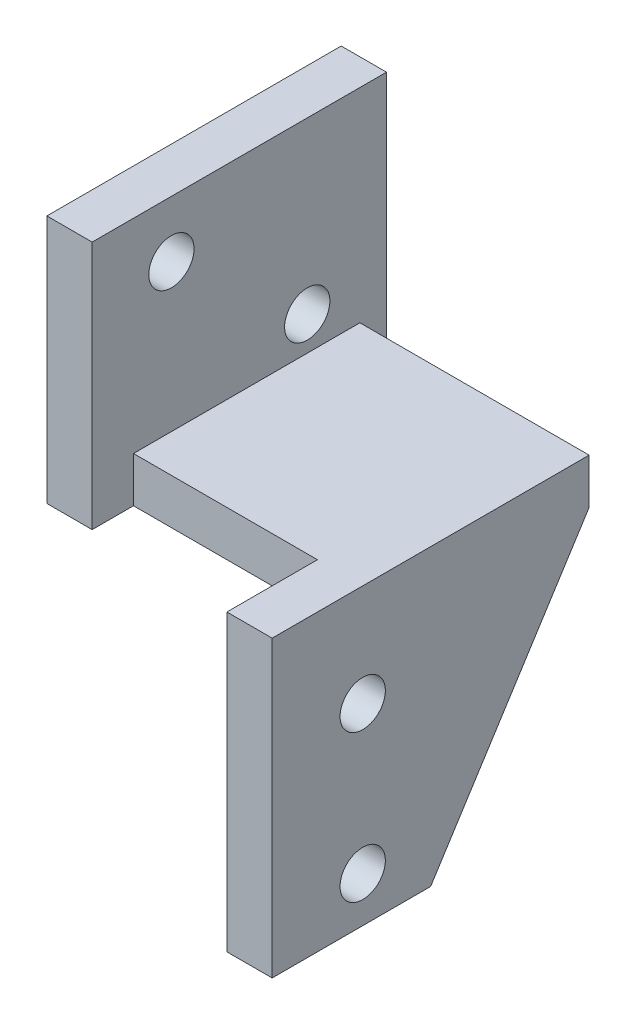
from build123d import *

# Parameters (mm, degrees)
BOSS_EXTRU_1_DEPTH      = 20
ESQUISSE3_W             = 4
ESQUISSE3_H             = 18
BOSS_EXTRU_2_DEPTH      = 20
ESQUISSE4_W             = 4
ESQUISSE4_H             = 18
BOSS_EXTRU_3_DEPTH      = 20
ESQUISSE5_W             = 17.65
ESQUISSE5_H             = 18
ESQUISSE5_W_2           = 16.35
ESQUISSE5_R             = 2
ENL_V_MAT_EXTRU_1_DEPTH = 20
ESQUISSE6_W             = 4
ESQUISSE6_H             = 26
BOSS_EXTRU_4_DEPTH      = 4
ESQUISSE7_R             = 2
ENL_V_MAT_EXTRU_2_DEPTH = 4
ESQUISSE8_R             = 2
ENL_V_MAT_EXTRU_3_DEPTH = 4
ESQUISSE9_W             = 4
ESQUISSE9_H             = 26
BOSS_EXTRU_5_DEPTH      = 8
ENL_V_MAT_EXTRU_5_DEPTH = 8


with BuildPart() as part:
    # Esquisse1 → Boss.-Extru.1 (new body)
    with BuildSketch(Plane.XY):
        Polygon((0, 16), (0, 0), (24.25, 0), (24.25, 2), (4, 2), (4, 16), align=None)
        Polygon((24.25, 0), (0, 0), (0, -2), (20.25, -2), (20.25, -24), (24.25, -24), align=None)
    extrude(amount=BOSS_EXTRU_1_DEPTH)

    # Esquisse3 → Boss.-Extru.2 (add)
    with BuildSketch(Plane(origin=(0, 0, 0), x_dir=(-1, 0, 0), z_dir=(0, 0, -1))):
        with Locations((-2, 7)):
            Rectangle(ESQUISSE3_W, ESQUISSE3_H)
    extrude(amount=BOSS_EXTRU_2_DEPTH)

    # Esquisse4 → Boss.-Extru.3 (add)
    with BuildSketch(Plane.XY.offset(20)):
        with Locations((2, 7)):
            Rectangle(ESQUISSE4_W, ESQUISSE4_H)
    extrude(amount=BOSS_EXTRU_3_DEPTH)

    # Esquisse5 → Enlèv. mat.-Extru.1 (cut)
    with BuildSketch(Plane.ZY):
        with Locations((-11.175, 7)):
            Rectangle(ESQUISSE5_W, ESQUISSE5_H)
        with Locations((31.825, 7)):
            Rectangle(ESQUISSE5_W_2, ESQUISSE5_H)
        with Locations((16.65, 15)):
            Circle(ESQUISSE5_R)
        with Locations((4.65, 5)):
            Circle(ESQUISSE5_R)
    extrude(amount=-ENL_V_MAT_EXTRU_1_DEPTH, mode=Mode.SUBTRACT)

    # Esquisse6 → Boss.-Extru.4 (add)
    with BuildSketch(Plane(origin=(0, 16, 0), x_dir=(1, 0, 0), z_dir=(0, 1, 0))):
        with Locations((2, -10.65)):
            Rectangle(ESQUISSE6_W, ESQUISSE6_H)
    extrude(amount=BOSS_EXTRU_4_DEPTH)

    # Esquisse7 → Enlèv. mat.-Extru.2 (cut)
    with BuildSketch(Plane.ZY):
        with Locations((16.65, 15)):
            Circle(ESQUISSE7_R)
    extrude(amount=-ENL_V_MAT_EXTRU_2_DEPTH, mode=Mode.SUBTRACT)

    # Esquisse8 → Enlèv. mat.-Extru.3 (cut)
    with BuildSketch(Plane.ZY.offset(-20.25)):
        with Locations((20, -7)):
            Circle(ESQUISSE8_R)
        with Locations((20, -20)):
            Circle(ESQUISSE8_R)
    extrude(amount=-ENL_V_MAT_EXTRU_3_DEPTH, mode=Mode.SUBTRACT)

    # Esquisse9 → Boss.-Extru.5 (add)
    with BuildSketch(Plane.XY.offset(20)):
        with Locations((22.25, -11)):
            Rectangle(ESQUISSE9_W, ESQUISSE9_H)
    extrude(amount=BOSS_EXTRU_5_DEPTH)

    # Esquisse11 → Enlèv. mat.-Extru.5 (cut)
    with BuildSketch(Plane.ZY.offset(-20.25)):
        with BuildLine():
            ThreePointArc((20, -9), (21.414213562, -8.414213562), (22, -7))
            ThreePointArc((22, -7), (21.414213562, -5.585786438), (20, -5))
            Line((20, -5), (20, -9))
        make_face()
        with BuildLine():
            Line((20, -9), (20, -5))
            ThreePointArc((20, -5), (18, -7), (20, -9))
        make_face()
        with BuildLine():
            ThreePointArc((20, -22), (21.414213562, -21.414213562), (22, -20))
            ThreePointArc((22, -20), (21.414213562, -18.585786438), (20, -18))
            Line((20, -18), (20, -22))
        make_face()
        with BuildLine():
            Line((20, -22), (20, -18))
            ThreePointArc((20, -18), (18, -20), (20, -22))
        make_face()
        Polygon((14, -24), (0, -2), (0, -24), align=None)
    extrude(amount=-ENL_V_MAT_EXTRU_5_DEPTH, mode=Mode.SUBTRACT)


solid = part.part
